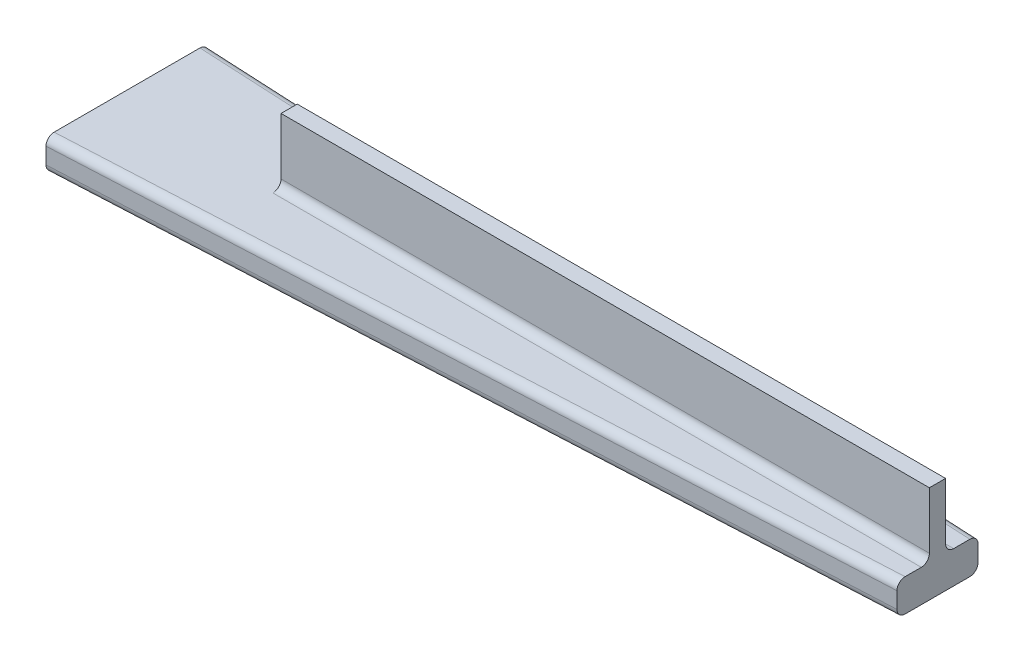
from build123d import *

# Parameters (mm, degrees)
BOSS_EXTRUDE1_DEPTH = 2
SKETCH2_W           = 40
SKETCH2_H           = 1
BOSS_EXTRUDE2_DEPTH = 4
FILLET1_R           = 0.5


with BuildPart() as part:
    # Sketch1 → Boss-Extrude1 (new body)
    with BuildSketch(Plane(origin=(0, 0, 0), x_dir=(1, 0, 0), z_dir=(0, 1, 0))):
        Polygon((0, -5), (0, 5), (50, 2.5), (50, -2.5), align=None)
    extrude(amount=BOSS_EXTRUDE1_DEPTH)

    # Sketch2 → Boss-Extrude2 (add)
    with BuildSketch(Plane(origin=(0, 2, 0), x_dir=(1, 0, 0), z_dir=(0, 1, 0))):
        with Locations((30, 0)):
            Rectangle(SKETCH2_W, SKETCH2_H)
    extrude(amount=BOSS_EXTRUDE2_DEPTH)

    # Fillet1
    fillet1_edges = [part.edges().sort_by_distance(p)[0] for p in [
        (25, 2, 3.75),
        (30, 2, -0.5),
        (30, 2, 0.5),
        (25, 2, -3.75),
        (25, 0, 3.75),
        (25, 0, -3.75),
    ]]
    fillet(fillet1_edges, radius=FILLET1_R)


solid = part.part
